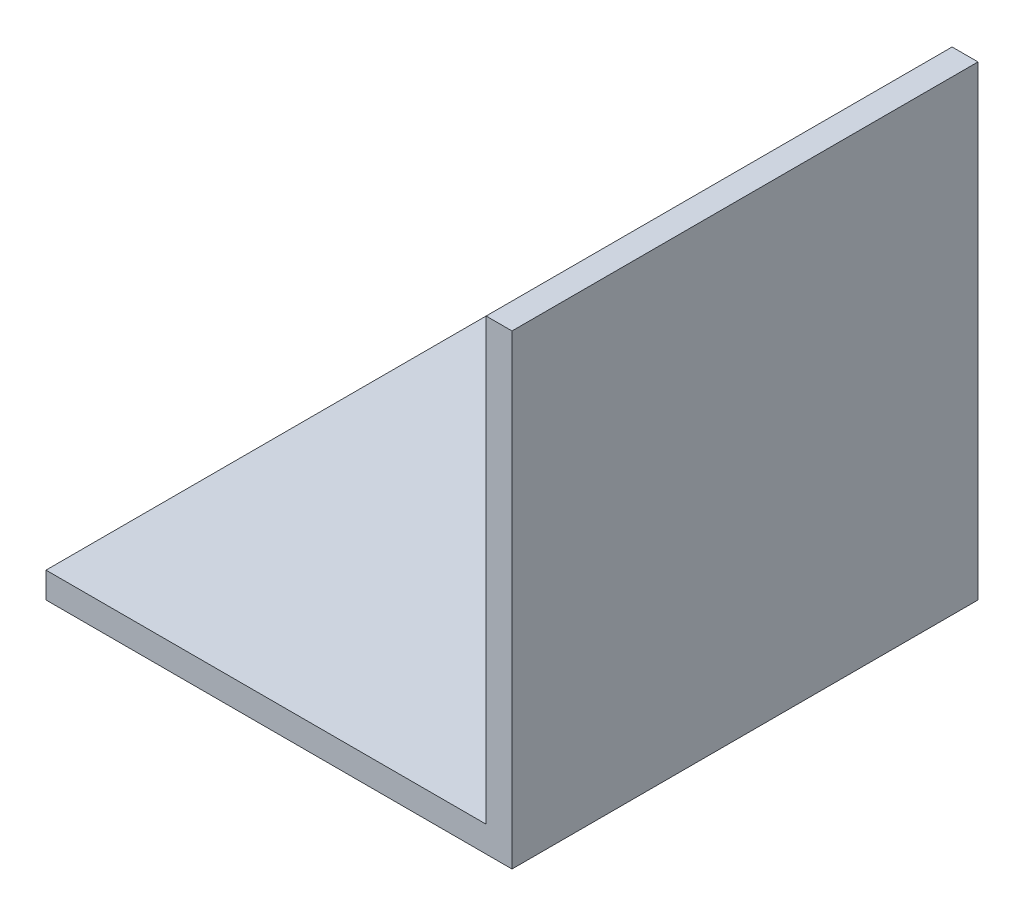
from build123d import *

# Parameters (mm, degrees)
SKETCH2_W           = 457.2
SKETCH2_H           = 457.2
BOSS_EXTRUDE1_DEPTH = 25.4
SKETCH3_W           = 25.4
SKETCH3_H           = 457.2
BOSS_EXTRUDE2_DEPTH = 431.8


with BuildPart() as part:
    # Sketch2 → Boss-Extrude1 (new body)
    with BuildSketch(Plane(origin=(0, 0, 0), x_dir=(1, 0, 0), z_dir=(0, 1, 0))):
        with Locations((-228.6, 228.6)):
            Rectangle(SKETCH2_W, SKETCH2_H)
    extrude(amount=BOSS_EXTRUDE1_DEPTH)

    # Sketch3 → Boss-Extrude2 (add)
    with BuildSketch(Plane(origin=(0, 25.4, 0), x_dir=(1, 0, 0), z_dir=(0, 1, 0))):
        with Locations((-12.7, 228.6)):
            Rectangle(SKETCH3_W, SKETCH3_H)
    extrude(amount=BOSS_EXTRUDE2_DEPTH)


solid = part.part
